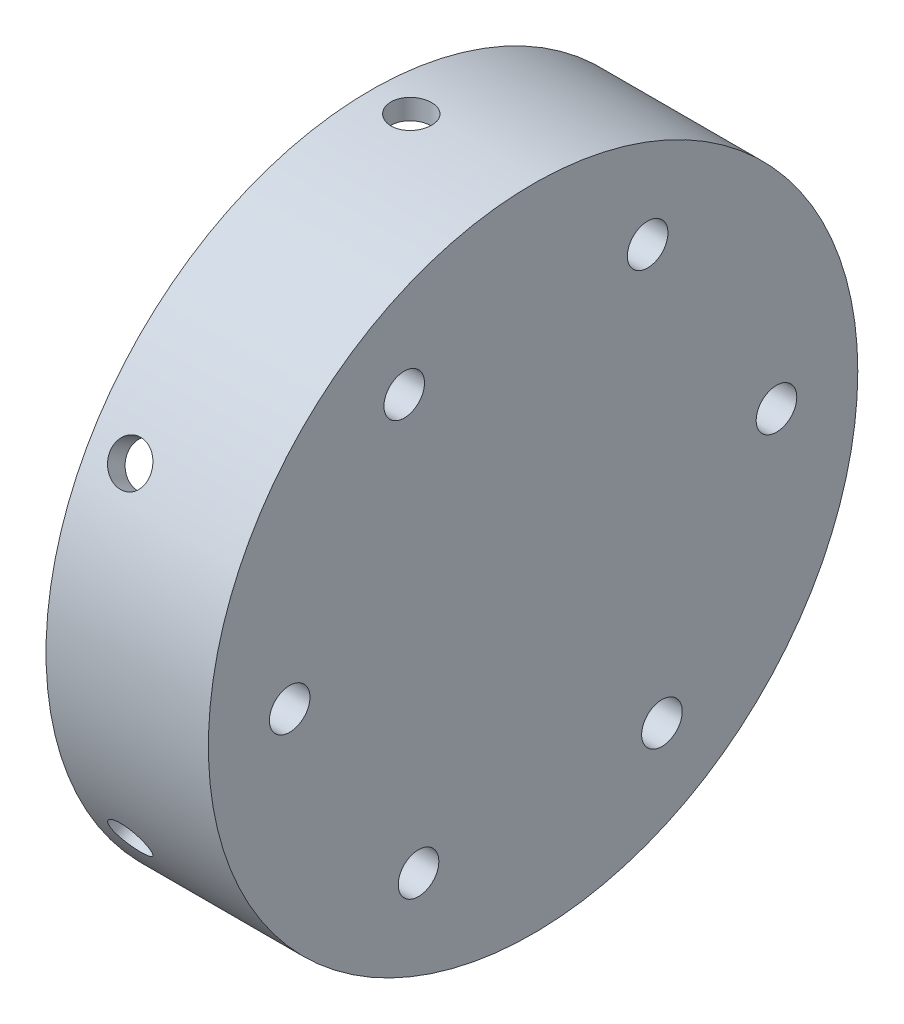
from build123d import *

# Parameters (mm, degrees)
SKETCH1_R               = 40
BOSS_EXTRUDE2_DEPTH     = 10
CUT_EXTRUDE1_DEPTH      = 58.445626465
CUT_EXTRUDE1_DEPTH_BACK = 58.445626465
SKETCH2_R               = 2.5
SKETCH3_R               = 37.5
CUT_EXTRUDE2_DEPTH      = 10
CUT_EXTRUDE3_REACH      = 92
CUT_EXTRUDE3_END_RADIUS = 37.5
SKETCH4_R               = 2.5
CIRPATTERN1_COUNT       = 6


with BuildPart() as part:
    # Sketch1 → Boss-Extrude2 (new, symmetric)
    with BuildSketch(Plane(origin=(0, 0, 0), x_dir=(0, 0, -1), z_dir=(1, 0, 0))):
        Circle(SKETCH1_R)
    extrude(amount=BOSS_EXTRUDE2_DEPTH, both=True)

    # Sketch2 → Cut-Extrude1 (cut, two sides: drawn at the far end of the back side and taken through both)
    with BuildSketch(Plane(origin=(0, 0, 0), x_dir=(0, 0, -1), z_dir=(1, 0, 0)).offset(-CUT_EXTRUDE1_DEPTH_BACK)):
        with Locations((14.110434629, 26.474433602)):
            Circle(SKETCH2_R)
        with Locations((29.982749365, 1.017221954)):
            Circle(SKETCH2_R)
        with Locations((15.872314736, -25.457211649)):
            Circle(SKETCH2_R)
        with Locations((-14.110434629, -26.474433602)):
            Circle(SKETCH2_R)
        with Locations((-29.982749365, -1.017221954)):
            Circle(SKETCH2_R)
        with Locations((-15.872314736, 25.457211649)):
            Circle(SKETCH2_R)
    extrude(amount=CUT_EXTRUDE1_DEPTH + CUT_EXTRUDE1_DEPTH_BACK, mode=Mode.SUBTRACT)

    # Sketch3 → Cut-Extrude2 (cut)
    with BuildSketch(Plane.ZY.offset(10)):
        Circle(SKETCH3_R)
    extrude(amount=-CUT_EXTRUDE2_DEPTH, mode=Mode.SUBTRACT)

    # Cut-Extrude3: up to this cylinder (the profile starts outside it)
    cut_extrude3_end = Plane(origin=(-5, 0, 0), z_dir=(-1, 0, 0)) * Cylinder(CUT_EXTRUDE3_END_RADIUS, 260, mode=Mode.PRIVATE)
    # Sketch4 → Cut-Extrude3 (cut, up to the surface)
    with BuildSketch(Plane(origin=(0, 40, 0), x_dir=(1, 0, 0), z_dir=(0, 1, 0)), mode=Mode.PRIVATE) as cut_extrude3_sk1:
        with Locations(Location((-5, 0, 0), (0, 0, 270))):
            Circle(SKETCH4_R)
    cut_extrude3_tool1 = extrude(cut_extrude3_sk1.sketch, amount=-CUT_EXTRUDE3_REACH, mode=Mode.PRIVATE) - cut_extrude3_end
    cut_extrude3 = cut_extrude3_tool1.solids().sort_by_distance((-5, 40, 0))[0]
    add(cut_extrude3, mode=Mode.SUBTRACT)

    # CirPattern1: Cut-Extrude3 ×6 about axis
    cirpattern1_axis = Axis((-10, 0, 0), (1, 0, 0))
    for i in range(1, CIRPATTERN1_COUNT):
        add(cut_extrude3.rotate(cirpattern1_axis, i * 360 / CIRPATTERN1_COUNT), mode=Mode.SUBTRACT)


solid = part.part
